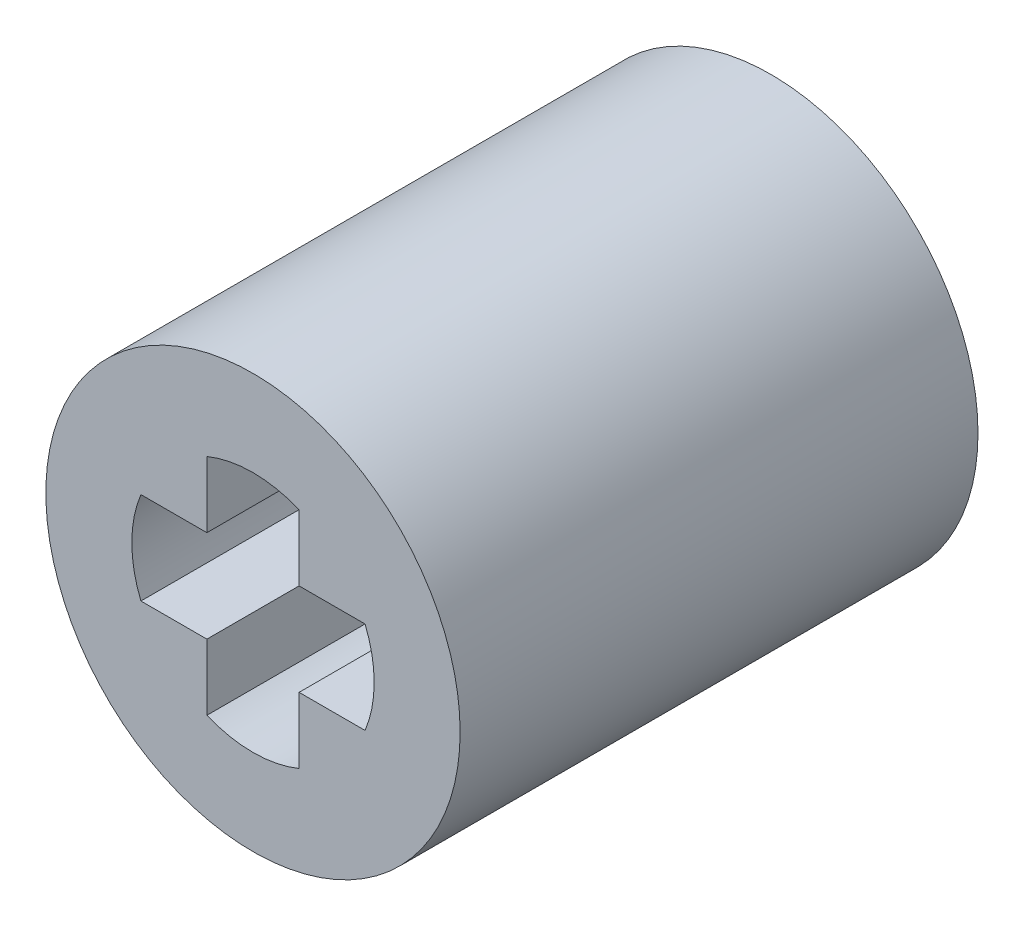
from build123d import *

# Parameters (mm, degrees)
SKETCH1_R           = 4
BOSS_EXTRUDE1_DEPTH = 5
BOSS_EXTRUDE2_START = -5
SKETCH1_3_R         = 4
BOSS_EXTRUDE2_DEPTH = 5


with BuildPart() as part:
    # Sketch1 → Boss-Extrude1 (new body)
    with BuildSketch(Plane.XY):
        Circle(SKETCH1_R)
        with BuildLine():
            ThreePointArc((-0.89, 2.164139552), (0, 2.34), (0.89, 2.164139552))
            Line((0.89, 2.164139552), (0.89, 0.89))
            Line((0.89, 0.89), (2.164139552, 0.89))
            ThreePointArc((2.164139552, 0.89), (2.34, 0), (2.164139552, -0.89))
            Line((2.164139552, -0.89), (0.89, -0.89))
            Line((0.89, -0.89), (0.89, -2.164139552))
            ThreePointArc((0.89, -2.164139552), (0, -2.34), (-0.89, -2.164139552))
            Line((-0.89, -2.164139552), (-0.89, -0.89))
            Line((-0.89, -0.89), (-2.164139552, -0.89))
            ThreePointArc((-2.164139552, -0.89), (-2.34, 0), (-2.164139552, 0.89))
            Line((-2.164139552, 0.89), (-0.89, 0.89))
            Line((-0.89, 0.89), (-0.89, 2.164139552))
        make_face(mode=Mode.SUBTRACT)
    extrude(amount=BOSS_EXTRUDE1_DEPTH)

    # Sketch1<3> → Boss-Extrude2 (add)
    with BuildSketch(Plane.XY.offset(BOSS_EXTRUDE2_START)):
        Circle(SKETCH1_3_R)
        with BuildLine():
            ThreePointArc((1.118033989, 1), (0, -1.5), (-1.118033989, 1))
            Line((-1.118033989, 1), (1.118033989, 1))
        make_face(mode=Mode.SUBTRACT)
    extrude(amount=BOSS_EXTRUDE2_DEPTH)


solid = part.part
